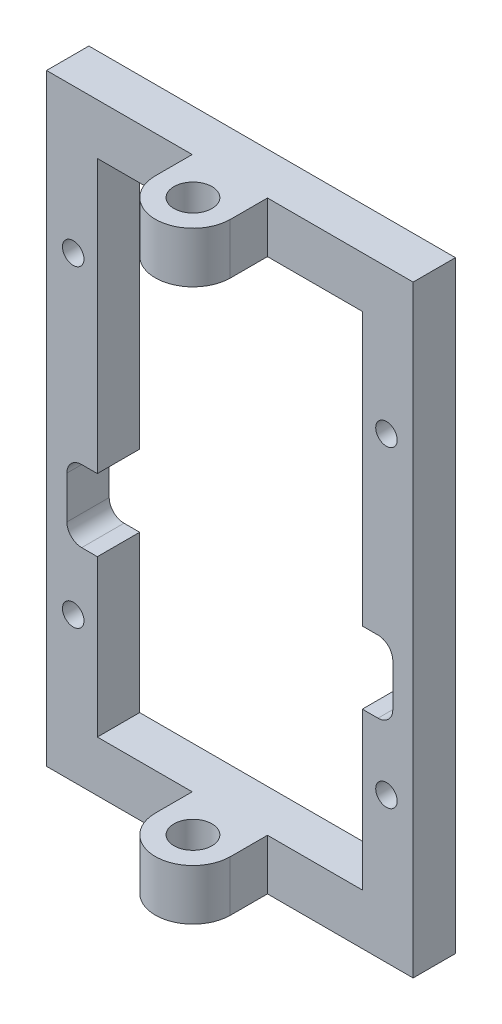
from build123d import *

# Parameters (mm, degrees)
SKETCH2_W               = 43.3
SKETCH2_H               = 71.19
SKETCH2_W_2             = 31.3
SKETCH2_H_2             = 59.19
BOSS_EXTRUDE1_DEPTH     = 5
SKETCH3_W               = 8.89
SKETCH3_H               = 6
BOSS_EXTRUDE2_DEPTH     = 8.8
CUT_EXTRUDE1_DEPTH      = 76.678124977
CUT_EXTRUDE1_DEPTH_BACK = 76.678124977
SKETCH5_R               = 2.2479
SKETCH6_R               = 1.75
SKETCH6_R_2             = 1.27
CUT_EXTRUDE2_DEPTH      = 5


with BuildPart() as part:
    # Sketch2 → Boss-Extrude1 (new body)
    with BuildSketch(Plane.XY):
        Rectangle(SKETCH2_W, SKETCH2_H)
        Rectangle(SKETCH2_W_2, SKETCH2_H_2, mode=Mode.SUBTRACT)
    extrude(amount=BOSS_EXTRUDE1_DEPTH)

    # Sketch3 → Boss-Extrude2 (add)
    with BuildSketch(Plane.XY.offset(5)):
        with Locations((0, 32.595)):
            Rectangle(SKETCH3_W, SKETCH3_H)
        with Locations((0, -32.595)):
            Rectangle(SKETCH3_W, SKETCH3_H)
    extrude(amount=BOSS_EXTRUDE2_DEPTH)

    # Sketch5 → Cut-Extrude1 (cut, two sides: drawn at the far end of the back side and taken through both)
    with BuildSketch(Plane(origin=(0, 35.595, 0), x_dir=(1, 0, 0), z_dir=(0, 1, 0)).offset(-CUT_EXTRUDE1_DEPTH_BACK)):
        with BuildLine():
            Line((-4.445, -13.8), (-2.8e-08, -13.8))
            ThreePointArc((-2.8e-08, -13.8), (-3.127220221, -12.513973022), (-4.445, -9.4))
            Line((-4.445, -9.4), (-4.445, -13.8))
        make_face()
        with BuildLine():
            Line((4.445, -13.8), (4.445, -9.4))
            ThreePointArc((4.445, -9.4), (3.127220202, -12.513973041), (-2.8e-08, -13.8))
            Line((-2.8e-08, -13.8), (4.445, -13.8))
        make_face()
        with Locations(Location((0, -9.354769886, 0), (0, 0, 90))):
            Circle(SKETCH5_R)
    extrude(amount=CUT_EXTRUDE1_DEPTH + CUT_EXTRUDE1_DEPTH_BACK, mode=Mode.SUBTRACT)

    # Sketch6 → Cut-Extrude2 (cut)
    with BuildSketch(Plane(origin=(0, 0, 0), x_dir=(-1, 0, 0), z_dir=(0, 0, -1))):
        with BuildLine():
            Line((-15.65, -2.589888065), (-17.5, -2.589888065))
            ThreePointArc((-17.5, -2.589888065), (-16.262563133, -3.102451197), (-15.75, -4.339888065))
            ThreePointArc((-15.75, -4.339888065), (-17.5, -6.089888065), (-19.25, -4.339888065))
            Line((-19.25, -4.339888065), (-19.25, -9.339888065))
            ThreePointArc((-19.25, -9.339888065), (-17.5, -7.589888065), (-15.75, -9.339888065))
            ThreePointArc((-15.75, -9.339888065), (-16.262563133, -10.577324932), (-17.5, -11.089888065))
            Line((-17.5, -11.089888065), (-15.65, -11.089888065))
            Line((-15.65, -11.089888065), (-15.65, -2.589888065))
        make_face()
        with Locations((-17.5, -4.339888065)):
            Circle(SKETCH6_R)
        with Locations((-17.5, -9.339888065)):
            Circle(SKETCH6_R)
        with Locations((17.5, -9.395)):
            Circle(SKETCH6_R)
        with BuildLine():
            ThreePointArc((19.25, -4.395), (16.262563133, -5.632436867), (17.5, -2.645))
            Line((17.5, -2.645), (15.65, -2.645))
            Line((15.65, -2.645), (15.65, -11.145))
            Line((15.65, -11.145), (17.5, -11.145))
            ThreePointArc((17.5, -11.145), (16.262563133, -8.157563133), (19.25, -9.395))
            Line((19.25, -9.395), (19.25, -4.395))
        make_face()
        with Locations((17.5, -4.395)):
            Circle(SKETCH6_R)
        with Locations((-18.5, 18.49499991)):
            Circle(SKETCH6_R_2)
        with Locations((18.5, 18.495)):
            Circle(SKETCH6_R_2)
        with Locations((18.5, -18.495)):
            Circle(SKETCH6_R_2)
        with Locations((-18.49999995, -18.439888065)):
            Circle(SKETCH6_R_2)
    extrude(amount=-CUT_EXTRUDE2_DEPTH, mode=Mode.SUBTRACT)


solid = part.part
